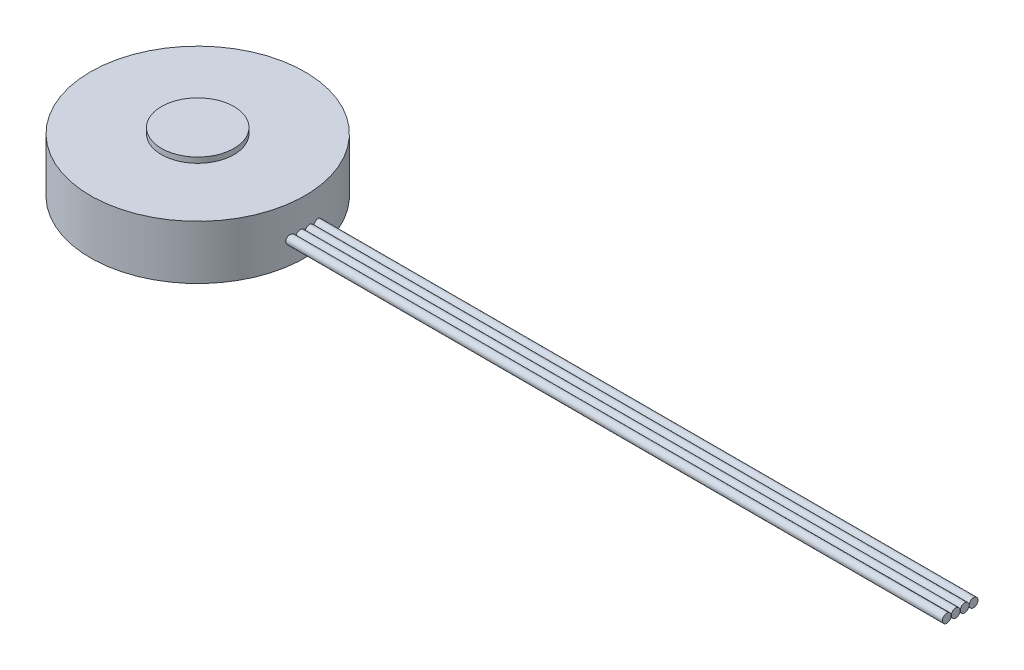
from build123d import *

# Parameters (mm, degrees)
SKETCH3_R           = 0.405
BOSS_EXTRUDE2_DEPTH = 70


with BuildPart() as part:
    # Sketch2 → Revolve1 (revolve)
    with BuildSketch(Plane.XY):
        Polygon((0, 0), (-9.85, 0), (-9.85, 4.95), (-3.328991597, 4.95), (-3.328991597, 5.45), (0, 5.45), align=None)
    revolve(axis=Axis((0, 5.45, 0), (0, -1, 0)))

    # Sketch3 → Boss-Extrude2 (add)
    with BuildSketch(Plane(origin=(0, 0, 0), x_dir=(0, 0, -1), z_dir=(1, 0, 0))):
        with Locations(Location((-0.41, 2.05, 0), (0, 0, 180))):
            Circle(SKETCH3_R)
        with Locations(Location((-1.23, 2.05, 0), (0, 0, 180))):
            Circle(SKETCH3_R)
        with Locations(Location((1.23, 2.05, 0), (0, 0, 180))):
            Circle(SKETCH3_R)
        with Locations(Location((0.41, 2.05, 0), (0, 0, 180))):
            Circle(SKETCH3_R)
    extrude(amount=BOSS_EXTRUDE2_DEPTH)


solid = part.part
